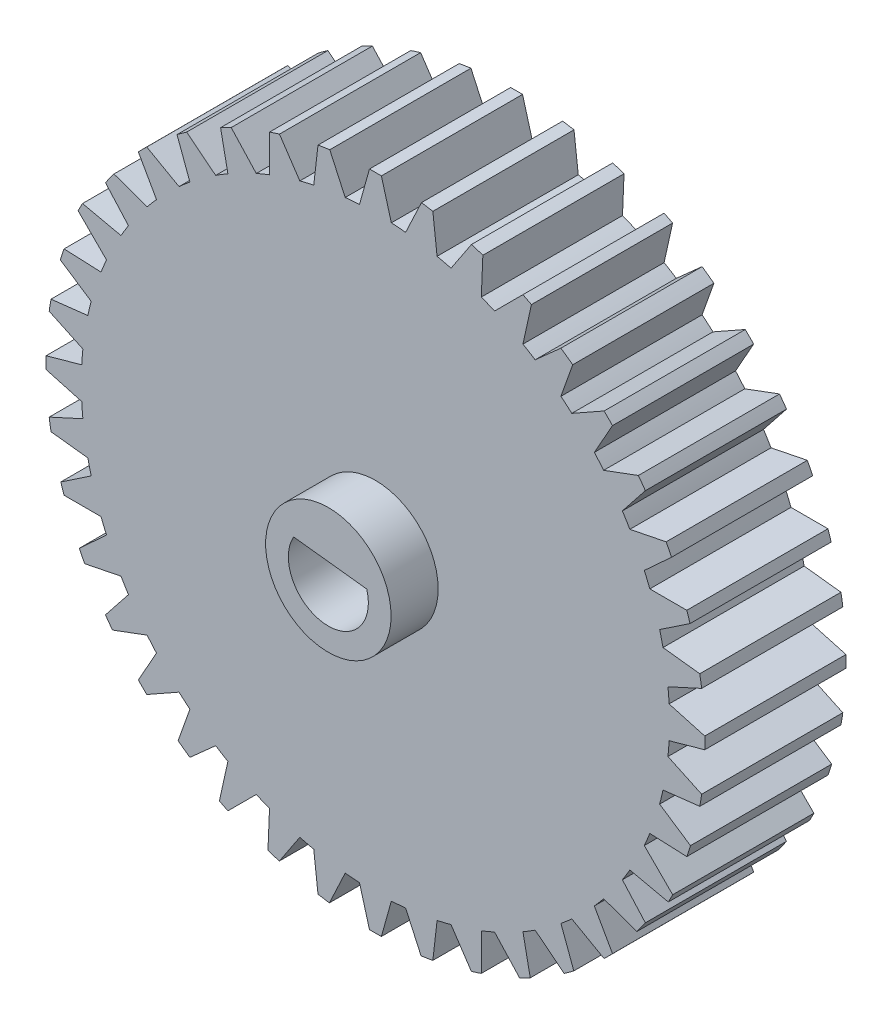
from build123d import *

# Parameters (mm, degrees)
SKETCH_1_R       = 8
EXTRUDE_1_DEPTH  = 24
SKETCH_2_R       = 37.5
SKETCH_2_R_2     = 8
EXTRUDE_2_DEPTH  = 18
EXTRUDE_3_DEPTH  = 18
EXTRUDE_4_DEPTH  = 18
EXTRUDE_5_DEPTH  = 18
EXTRUDE_6_DEPTH  = 18
EXTRUDE_7_DEPTH  = 18
EXTRUDE_8_DEPTH  = 18
EXTRUDE_9_DEPTH  = 18
EXTRUDE_10_DEPTH = 18
EXTRUDE_11_DEPTH = 18
EXTRUDE_12_DEPTH = 18
EXTRUDE_13_DEPTH = 18
EXTRUDE_14_DEPTH = 18
EXTRUDE_15_DEPTH = 18
EXTRUDE_16_DEPTH = 18
EXTRUDE_17_DEPTH = 18
EXTRUDE_18_DEPTH = 18
EXTRUDE_19_DEPTH = 18
EXTRUDE_20_DEPTH = 18
EXTRUDE_21_DEPTH = 18
EXTRUDE_22_DEPTH = 18
EXTRUDE_23_DEPTH = 18
EXTRUDE_24_DEPTH = 18
EXTRUDE_25_DEPTH = 18
EXTRUDE_26_DEPTH = 18
EXTRUDE_27_DEPTH = 18
EXTRUDE_28_DEPTH = 18
EXTRUDE_29_DEPTH = 18
EXTRUDE_30_DEPTH = 18
EXTRUDE_31_DEPTH = 18
EXTRUDE_32_DEPTH = 18
EXTRUDE_33_DEPTH = 18
EXTRUDE_34_DEPTH = 18
EXTRUDE_35_DEPTH = 18
EXTRUDE_36_DEPTH = 18
EXTRUDE_37_DEPTH = 18
EXTRUDE_38_DEPTH = 18
EXTRUDE_39_DEPTH = 18
EXTRUDE_40_DEPTH = 18
EXTRUDE_41_DEPTH = 18
EXTRUDE_42_DEPTH = 18


with BuildPart() as part:
    # 草图1 → 凸台-拉伸1 (new body)
    with BuildSketch(Plane.XY):
        Circle(SKETCH_1_R)
        with BuildLine():
            Line((4.89403723, 1.434712371), (-4.42388764, 2.537561456))
            ThreePointArc((-4.42388764, 2.537561456), (-0.599440727, -5.06464913), (4.89403723, 1.434712371))
        make_face(mode=Mode.SUBTRACT)
    extrude(amount=EXTRUDE_1_DEPTH)

    # 草图2 → 凸台-拉伸2 (add)
    with BuildSketch(Plane.XY):
        Circle(SKETCH_2_R)
        Circle(SKETCH_2_R_2, mode=Mode.SUBTRACT)
    extrude(amount=EXTRUDE_2_DEPTH)

    # 草图3 → 凸台-拉伸3 (add)
    with BuildSketch(Plane.XY):
        with BuildLine():
            Line((37.444984946, 2.030542387), (41.993111969, 0.760622898))
            ThreePointArc((41.993111969, 0.760622898), (42, 0), (41.993111969, -0.760622898))
            Line((41.993111969, -0.760622898), (37.444984946, -2.030542387))
            ThreePointArc((37.444984946, -2.030542387), (37.5, 0), (37.444984946, 2.030542387))
        make_face()
    extrude(amount=EXTRUDE_3_DEPTH)

    # 草图4 → 凸台-拉伸4 (add)
    with BuildSketch(Plane.XY):
        with BuildLine():
            Line((36.666328233, 7.863229229), (41.357119441, 7.320428374))
            ThreePointArc((41.357119441, 7.320428374), (41.482910305, 6.570247532), (41.595094713, 5.817911638))
            Line((41.595094713, 5.817911638), (37.301621857, 3.852143148))
            ThreePointArc((37.301621857, 3.852143148), (37.038312772, 5.866292439), (36.666328233, 7.863229229))
        make_face()
    extrude(amount=EXTRUDE_4_DEPTH)

    # 草图5 → 凸台-拉伸5 (add)
    with BuildSketch(Plane.XY):
        with BuildLine():
            Line((34.98482483, 13.502297271), (39.702777375, 13.502297271))
            ThreePointArc((39.702777375, 13.502297271), (39.912217543, 12.870021513), (40.111589279, 12.234499108))
            Line((40.111589279, 12.234499108), (36.239769041, 9.639976134))
            ThreePointArc((36.239769041, 9.639976134), (35.664619361, 11.588137289), (34.98482483, 13.502297271))
        make_face()
    extrude(amount=EXTRUDE_5_DEPTH)

    # 草图6 → 凸台-拉伸6 (add)
    with BuildSketch(Plane.XY):
        with BuildLine():
            Line((32.441878932, 18.808893943), (37.070821165, 19.742193853))
            ThreePointArc((37.070821165, 19.742193853), (37.422274016, 19.067600989), (37.761452305, 18.386753924))
            Line((37.761452305, 18.386753924), (34.285572838, 15.190440914))
            ThreePointArc((34.285572838, 15.190440914), (33.412744657, 17.02464374), (32.441878932, 18.808893943))
        make_face()
    extrude(amount=EXTRUDE_6_DEPTH)

    # 草图7 → 凸台-拉伸7 (add)
    with BuildSketch(Plane.XY):
        with BuildLine():
            Line((29.100106306, 23.652353223), (33.526058307, 25.298288764))
            ThreePointArc((33.526058307, 25.298288764), (33.978713764, 24.686980596), (34.420224151, 24.067575062))
            Line((34.420224151, 24.067575062), (31.487152045, 20.366866625))
            ThreePointArc((31.487152045, 20.366866625), (30.338137289, 22.041946961), (29.100106306, 23.652353223))
        make_face()
    extrude(amount=EXTRUDE_7_DEPTH)

    # 草图8 → 凸台-拉伸8 (add)
    with BuildSketch(Plane.XY):
        with BuildLine():
            Line((25.041792485, 27.913413068), (29.155772627, 30.231455845))
            ThreePointArc((29.155772627, 30.231455845), (29.69848481, 29.69848481), (30.231455845, 29.155772627))
            Line((30.231455845, 29.155772627), (27.913413068, 25.041792485))
            ThreePointArc((27.913413068, 25.041792485), (26.516504294, 26.516504294), (25.041792485, 27.913413068))
        make_face()
    extrude(amount=EXTRUDE_8_DEPTH)

    # 草图9 → 凸台-拉伸9 (add)
    with BuildSketch(Plane.XY):
        with BuildLine():
            Line((20.366866625, 31.487152045), (23.652353223, 34.420224151))
            ThreePointArc((23.652353223, 34.420224151), (24.410085603, 33.887067805), (25.155804377, 33.337233684))
            Line((25.155804377, 33.337233684), (23.652353223, 29.100106306))
            ThreePointArc((23.652353223, 29.100106306), (22.041946961, 30.338137289), (20.366866625, 31.487152045))
        make_face()
    extrude(amount=EXTRUDE_9_DEPTH)

    # 草图10 → 凸台-拉伸10 (add)
    with BuildSketch(Plane.XY):
        with BuildLine():
            Line((15.190440914, 34.285572838), (18.808893943, 37.904025867))
            ThreePointArc((18.808893943, 37.904025867), (19.351380194, 37.629958183), (19.889873971, 37.348126884))
            Line((19.889873971, 37.348126884), (18.808893943, 32.441878932))
            ThreePointArc((18.808893943, 32.441878932), (17.02464374, 33.412744657), (15.190440914, 34.285572838))
        make_face()
    extrude(amount=EXTRUDE_10_DEPTH)

    # 草图11 → 凸台-拉伸11 (add)
    with BuildSketch(Plane.XY):
        with BuildLine():
            Line((9.639976134, 36.239769041), (12.253189882, 40.172868179))
            ThreePointArc((12.253189882, 40.172868179), (12.978713764, 39.944373684), (13.699980608, 39.702777375))
            Line((13.699980608, 39.702777375), (13.502297271, 34.98482483))
            ThreePointArc((13.502297271, 34.98482483), (11.588137289, 35.664619361), (9.639976134, 36.239769041))
        make_face()
    extrude(amount=EXTRUDE_11_DEPTH)

    # 草图12 → 凸台-拉伸12 (add)
    with BuildSketch(Plane.XY):
        with BuildLine():
            Line((3.852143148, 37.301621857), (5.866292439, 41.595094713))
            ThreePointArc((5.866292439, 41.595094713), (6.59496137, 41.485802098), (7.321601232, 41.363745558))
            Line((7.321601232, 41.363745558), (7.863229229, 36.666328233))
            ThreePointArc((7.863229229, 36.666328233), (5.866292439, 37.038312772), (3.852143148, 37.301621857))
        make_face()
    extrude(amount=EXTRUDE_12_DEPTH)

    # 草图13 → 凸台-拉伸13 (add)
    with BuildSketch(Plane.XY):
        with BuildLine():
            Line((-2.030542387, 37.444984946), (-0.760622898, 41.993111969))
            ThreePointArc((-0.760622898, 41.993111969), (0, 42), (0.760622898, 41.993111969))
            Line((0.760622898, 41.993111969), (2.030542387, 37.444984946))
            ThreePointArc((2.030542387, 37.444984946), (0, 37.5), (-2.030542387, 37.444984946))
        make_face()
    extrude(amount=EXTRUDE_13_DEPTH)

    # 草图14 → 凸台-拉伸14 (add)
    with BuildSketch(Plane.XY):
        with BuildLine():
            Line((-7.863229229, 36.666328233), (-7.320428374, 41.357119441))
            ThreePointArc((-7.320428374, 41.357119441), (-6.570247532, 41.482910305), (-5.817911638, 41.595094713))
            Line((-5.817911638, 41.595094713), (-3.852143148, 37.301621857))
            ThreePointArc((-3.852143148, 37.301621857), (-5.866292439, 37.038312772), (-7.863229229, 36.666328233))
        make_face()
    extrude(amount=EXTRUDE_14_DEPTH)

    # 草图15 → 凸台-拉伸15 (add)
    with BuildSketch(Plane.XY):
        with BuildLine():
            Line((-13.502297271, 34.98482483), (-13.502297271, 39.702777375))
            ThreePointArc((-13.502297271, 39.702777375), (-12.870021513, 39.912217543), (-12.234499108, 40.111589279))
            Line((-12.234499108, 40.111589279), (-9.639976134, 36.239769041))
            ThreePointArc((-9.639976134, 36.239769041), (-11.588137289, 35.664619361), (-13.502297271, 34.98482483))
        make_face()
    extrude(amount=EXTRUDE_15_DEPTH)

    # 草图16 → 凸台-拉伸16 (add)
    with BuildSketch(Plane.XY):
        with BuildLine():
            Line((-18.808893943, 32.441878932), (-19.742193853, 37.070821165))
            ThreePointArc((-19.742193853, 37.070821165), (-19.067600989, 37.422274016), (-18.386753924, 37.761452305))
            Line((-18.386753924, 37.761452305), (-15.190440914, 34.285572838))
            ThreePointArc((-15.190440914, 34.285572838), (-17.02464374, 33.412744657), (-18.808893943, 32.441878932))
        make_face()
    extrude(amount=EXTRUDE_16_DEPTH)

    # 草图17 → 凸台-拉伸17 (add)
    with BuildSketch(Plane.XY):
        with BuildLine():
            Line((-23.652353223, 29.100106306), (-25.298288764, 33.526058307))
            ThreePointArc((-25.298288764, 33.526058307), (-24.686980596, 33.978713764), (-24.067575062, 34.420224151))
            Line((-24.067575062, 34.420224151), (-20.366866625, 31.487152045))
            ThreePointArc((-20.366866625, 31.487152045), (-22.041946961, 30.338137289), (-23.652353223, 29.100106306))
        make_face()
    extrude(amount=EXTRUDE_17_DEPTH)

    # 草图18 → 凸台-拉伸18 (add)
    with BuildSketch(Plane.XY):
        with BuildLine():
            Line((-27.913413068, 25.041792485), (-30.231455845, 29.155772627))
            ThreePointArc((-30.231455845, 29.155772627), (-29.69848481, 29.69848481), (-29.155772627, 30.231455845))
            Line((-29.155772627, 30.231455845), (-25.041792485, 27.913413068))
            ThreePointArc((-25.041792485, 27.913413068), (-26.516504294, 26.516504294), (-27.913413068, 25.041792485))
        make_face()
    extrude(amount=EXTRUDE_18_DEPTH)

    # 草图19 → 凸台-拉伸19 (add)
    with BuildSketch(Plane.XY):
        with BuildLine():
            Line((-31.487152045, 20.366866625), (-34.420224151, 23.652353223))
            ThreePointArc((-34.420224151, 23.652353223), (-33.887067805, 24.410085603), (-33.337233684, 25.155804377))
            Line((-33.337233684, 25.155804377), (-29.100106306, 23.652353223))
            ThreePointArc((-29.100106306, 23.652353223), (-30.338137289, 22.041946961), (-31.487152045, 20.366866625))
        make_face()
    extrude(amount=EXTRUDE_19_DEPTH)

    # 草图20 → 凸台-拉伸20 (add)
    with BuildSketch(Plane.XY):
        with BuildLine():
            Line((-34.285572838, 15.190440914), (-37.904025867, 18.808893943))
            ThreePointArc((-37.904025867, 18.808893943), (-37.629958183, 19.351380194), (-37.348126884, 19.889873971))
            Line((-37.348126884, 19.889873971), (-32.441878932, 18.808893943))
            ThreePointArc((-32.441878932, 18.808893943), (-33.412744657, 17.02464374), (-34.285572838, 15.190440914))
        make_face()
    extrude(amount=EXTRUDE_20_DEPTH)

    # 草图21 → 凸台-拉伸21 (add)
    with BuildSketch(Plane.XY):
        with BuildLine():
            Line((-36.239769041, 9.639976134), (-40.172868179, 12.253189882))
            ThreePointArc((-40.172868179, 12.253189882), (-39.944373684, 12.978713764), (-39.702777375, 13.699980608))
            Line((-39.702777375, 13.699980608), (-34.98482483, 13.502297271))
            ThreePointArc((-34.98482483, 13.502297271), (-35.664619361, 11.588137289), (-36.239769041, 9.639976134))
        make_face()
    extrude(amount=EXTRUDE_21_DEPTH)

    # 草图22 → 凸台-拉伸22 (add)
    with BuildSketch(Plane.XY):
        with BuildLine():
            Line((-37.301621857, 3.852143148), (-41.595094713, 5.866292439))
            ThreePointArc((-41.595094713, 5.866292439), (-41.485802098, 6.59496137), (-41.363745558, 7.321601232))
            Line((-41.363745558, 7.321601232), (-36.666328233, 7.863229229))
            ThreePointArc((-36.666328233, 7.863229229), (-37.038312772, 5.866292439), (-37.301621857, 3.852143148))
        make_face()
    extrude(amount=EXTRUDE_22_DEPTH)

    # 草图23 → 凸台-拉伸23 (add)
    with BuildSketch(Plane.XY):
        with BuildLine():
            Line((-37.444984946, -2.030542387), (-41.993111969, -0.760622898))
            ThreePointArc((-41.993111969, -0.760622898), (-42, 0), (-41.993111969, 0.760622898))
            Line((-41.993111969, 0.760622898), (-37.444984946, 2.030542387))
            ThreePointArc((-37.444984946, 2.030542387), (-37.5, 0), (-37.444984946, -2.030542387))
        make_face()
    extrude(amount=EXTRUDE_23_DEPTH)

    # 草图24 → 凸台-拉伸24 (add)
    with BuildSketch(Plane.XY):
        with BuildLine():
            Line((-36.666328233, -7.863229229), (-41.357119441, -7.320428374))
            ThreePointArc((-41.357119441, -7.320428374), (-41.482910305, -6.570247532), (-41.595094713, -5.817911638))
            Line((-41.595094713, -5.817911638), (-37.301621857, -3.852143148))
            ThreePointArc((-37.301621857, -3.852143148), (-37.038312772, -5.866292439), (-36.666328233, -7.863229229))
        make_face()
    extrude(amount=EXTRUDE_24_DEPTH)

    # 草图25 → 凸台-拉伸25 (add)
    with BuildSketch(Plane.XY):
        with BuildLine():
            Line((-34.98482483, -13.502297271), (-39.702777375, -13.502297271))
            ThreePointArc((-39.702777375, -13.502297271), (-39.912217543, -12.870021513), (-40.111589279, -12.234499108))
            Line((-40.111589279, -12.234499108), (-36.239769041, -9.639976134))
            ThreePointArc((-36.239769041, -9.639976134), (-35.664619361, -11.588137289), (-34.98482483, -13.502297271))
        make_face()
    extrude(amount=EXTRUDE_25_DEPTH)

    # 草图26 → 凸台-拉伸26 (add)
    with BuildSketch(Plane.XY):
        with BuildLine():
            Line((-32.441878932, -18.808893943), (-37.070821165, -19.742193853))
            ThreePointArc((-37.070821165, -19.742193853), (-37.422274016, -19.067600989), (-37.761452305, -18.386753924))
            Line((-37.761452305, -18.386753924), (-34.285572838, -15.190440914))
            ThreePointArc((-34.285572838, -15.190440914), (-33.412744657, -17.02464374), (-32.441878932, -18.808893943))
        make_face()
    extrude(amount=EXTRUDE_26_DEPTH)

    # 草图27 → 凸台-拉伸27 (add)
    with BuildSketch(Plane.XY):
        with BuildLine():
            Line((-29.100106306, -23.652353223), (-33.526058307, -25.298288764))
            ThreePointArc((-33.526058307, -25.298288764), (-33.978713764, -24.686980596), (-34.420224151, -24.067575062))
            Line((-34.420224151, -24.067575062), (-31.487152045, -20.366866625))
            ThreePointArc((-31.487152045, -20.366866625), (-30.338137289, -22.041946961), (-29.100106306, -23.652353223))
        make_face()
    extrude(amount=EXTRUDE_27_DEPTH)

    # 草图28 → 凸台-拉伸28 (add)
    with BuildSketch(Plane.XY):
        with BuildLine():
            Line((-25.041792485, -27.913413068), (-29.155772627, -30.231455845))
            ThreePointArc((-29.155772627, -30.231455845), (-29.69848481, -29.69848481), (-30.231455845, -29.155772627))
            Line((-30.231455845, -29.155772627), (-27.913413068, -25.041792485))
            ThreePointArc((-27.913413068, -25.041792485), (-26.516504294, -26.516504294), (-25.041792485, -27.913413068))
        make_face()
    extrude(amount=EXTRUDE_28_DEPTH)

    # 草图29 → 凸台-拉伸29 (add)
    with BuildSketch(Plane.XY):
        with BuildLine():
            Line((-20.366866625, -31.487152045), (-23.652353223, -34.420224151))
            ThreePointArc((-23.652353223, -34.420224151), (-24.410085603, -33.887067805), (-25.155804377, -33.337233684))
            Line((-25.155804377, -33.337233684), (-23.652353223, -29.100106306))
            ThreePointArc((-23.652353223, -29.100106306), (-22.041946961, -30.338137289), (-20.366866625, -31.487152045))
        make_face()
    extrude(amount=EXTRUDE_29_DEPTH)

    # 草图30 → 凸台-拉伸30 (add)
    with BuildSketch(Plane.XY):
        with BuildLine():
            Line((-15.190440914, -34.285572838), (-18.808893943, -37.904025867))
            ThreePointArc((-18.808893943, -37.904025867), (-19.351380194, -37.629958183), (-19.889873971, -37.348126884))
            Line((-19.889873971, -37.348126884), (-18.808893943, -32.441878932))
            ThreePointArc((-18.808893943, -32.441878932), (-17.02464374, -33.412744657), (-15.190440914, -34.285572838))
        make_face()
    extrude(amount=EXTRUDE_30_DEPTH)

    # 草图31 → 凸台-拉伸31 (add)
    with BuildSketch(Plane.XY):
        with BuildLine():
            Line((-9.639976134, -36.239769041), (-12.253189882, -40.172868179))
            ThreePointArc((-12.253189882, -40.172868179), (-12.978713764, -39.944373684), (-13.699980608, -39.702777375))
            Line((-13.699980608, -39.702777375), (-13.502297271, -34.98482483))
            ThreePointArc((-13.502297271, -34.98482483), (-11.588137289, -35.664619361), (-9.639976134, -36.239769041))
        make_face()
    extrude(amount=EXTRUDE_31_DEPTH)

    # 草图32 → 凸台-拉伸32 (add)
    with BuildSketch(Plane.XY):
        with BuildLine():
            Line((-3.852143148, -37.301621857), (-5.866292439, -41.595094713))
            ThreePointArc((-5.866292439, -41.595094713), (-6.59496137, -41.485802098), (-7.321601232, -41.363745558))
            Line((-7.321601232, -41.363745558), (-7.863229229, -36.666328233))
            ThreePointArc((-7.863229229, -36.666328233), (-5.866292439, -37.038312772), (-3.852143148, -37.301621857))
        make_face()
    extrude(amount=EXTRUDE_32_DEPTH)

    # 草图33 → 凸台-拉伸33 (add)
    with BuildSketch(Plane.XY):
        with BuildLine():
            Line((2.030542387, -37.444984946), (0.760622898, -41.993111969))
            ThreePointArc((0.760622898, -41.993111969), (0, -42), (-0.760622898, -41.993111969))
            Line((-0.760622898, -41.993111969), (-2.030542387, -37.444984946))
            ThreePointArc((-2.030542387, -37.444984946), (0, -37.5), (2.030542387, -37.444984946))
        make_face()
    extrude(amount=EXTRUDE_33_DEPTH)

    # 草图34 → 凸台-拉伸34 (add)
    with BuildSketch(Plane.XY):
        with BuildLine():
            Line((7.863229229, -36.666328233), (7.320428374, -41.357119441))
            ThreePointArc((7.320428374, -41.357119441), (6.570247532, -41.482910305), (5.817911638, -41.595094713))
            Line((5.817911638, -41.595094713), (3.852143148, -37.301621857))
            ThreePointArc((3.852143148, -37.301621857), (5.866292439, -37.038312772), (7.863229229, -36.666328233))
        make_face()
    extrude(amount=EXTRUDE_34_DEPTH)

    # 草图35 → 凸台-拉伸35 (add)
    with BuildSketch(Plane.XY):
        with BuildLine():
            Line((13.502297271, -34.98482483), (13.502297271, -39.702777375))
            ThreePointArc((13.502297271, -39.702777375), (12.870021513, -39.912217543), (12.234499108, -40.111589279))
            Line((12.234499108, -40.111589279), (9.639976134, -36.239769041))
            ThreePointArc((9.639976134, -36.239769041), (11.588137289, -35.664619361), (13.502297271, -34.98482483))
        make_face()
    extrude(amount=EXTRUDE_35_DEPTH)

    # 草图36 → 凸台-拉伸36 (add)
    with BuildSketch(Plane.XY):
        with BuildLine():
            Line((18.808893943, -32.441878932), (19.742193853, -37.070821165))
            ThreePointArc((19.742193853, -37.070821165), (19.067600989, -37.422274016), (18.386753924, -37.761452305))
            Line((18.386753924, -37.761452305), (15.190440914, -34.285572838))
            ThreePointArc((15.190440914, -34.285572838), (17.02464374, -33.412744657), (18.808893943, -32.441878932))
        make_face()
    extrude(amount=EXTRUDE_36_DEPTH)

    # 草图37 → 凸台-拉伸37 (add)
    with BuildSketch(Plane.XY):
        with BuildLine():
            Line((23.652353223, -29.100106306), (25.298288764, -33.526058307))
            ThreePointArc((25.298288764, -33.526058307), (24.686980596, -33.978713764), (24.067575062, -34.420224151))
            Line((24.067575062, -34.420224151), (20.366866625, -31.487152045))
            ThreePointArc((20.366866625, -31.487152045), (22.041946961, -30.338137289), (23.652353223, -29.100106306))
        make_face()
    extrude(amount=EXTRUDE_37_DEPTH)

    # 草图38 → 凸台-拉伸38 (add)
    with BuildSketch(Plane.XY):
        with BuildLine():
            Line((27.913413068, -25.041792485), (30.231455845, -29.155772627))
            ThreePointArc((30.231455845, -29.155772627), (29.69848481, -29.69848481), (29.155772627, -30.231455845))
            Line((29.155772627, -30.231455845), (25.041792485, -27.913413068))
            ThreePointArc((25.041792485, -27.913413068), (26.516504294, -26.516504294), (27.913413068, -25.041792485))
        make_face()
    extrude(amount=EXTRUDE_38_DEPTH)

    # 草图39 → 凸台-拉伸39 (add)
    with BuildSketch(Plane.XY):
        with BuildLine():
            Line((31.487152045, -20.366866625), (34.420224151, -23.652353223))
            ThreePointArc((34.420224151, -23.652353223), (33.887067805, -24.410085603), (33.337233684, -25.155804377))
            Line((33.337233684, -25.155804377), (29.100106306, -23.652353223))
            ThreePointArc((29.100106306, -23.652353223), (30.338137289, -22.041946961), (31.487152045, -20.366866625))
        make_face()
    extrude(amount=EXTRUDE_39_DEPTH)

    # 草图40 → 凸台-拉伸40 (add)
    with BuildSketch(Plane.XY):
        with BuildLine():
            Line((34.285572838, -15.190440914), (37.904025867, -18.808893943))
            ThreePointArc((37.904025867, -18.808893943), (37.629958183, -19.351380194), (37.348126884, -19.889873971))
            Line((37.348126884, -19.889873971), (32.441878932, -18.808893943))
            ThreePointArc((32.441878932, -18.808893943), (33.412744657, -17.02464374), (34.285572838, -15.190440914))
        make_face()
    extrude(amount=EXTRUDE_40_DEPTH)

    # 草图41 → 凸台-拉伸41 (add)
    with BuildSketch(Plane.XY):
        with BuildLine():
            Line((36.239769041, -9.639976134), (40.172868179, -12.253189882))
            ThreePointArc((40.172868179, -12.253189882), (39.944373684, -12.978713764), (39.702777375, -13.699980608))
            Line((39.702777375, -13.699980608), (34.98482483, -13.502297271))
            ThreePointArc((34.98482483, -13.502297271), (35.664619361, -11.588137289), (36.239769041, -9.639976134))
        make_face()
    extrude(amount=EXTRUDE_41_DEPTH)

    # 草图42 → 凸台-拉伸42 (add)
    with BuildSketch(Plane.XY):
        with BuildLine():
            Line((37.301621857, -3.852143148), (41.595094713, -5.866292439))
            ThreePointArc((41.595094713, -5.866292439), (41.485802098, -6.59496137), (41.363745558, -7.321601232))
            Line((41.363745558, -7.321601232), (36.666328233, -7.863229229))
            ThreePointArc((36.666328233, -7.863229229), (37.038312772, -5.866292439), (37.301621857, -3.852143148))
        make_face()
    extrude(amount=EXTRUDE_42_DEPTH)


solid = part.part
